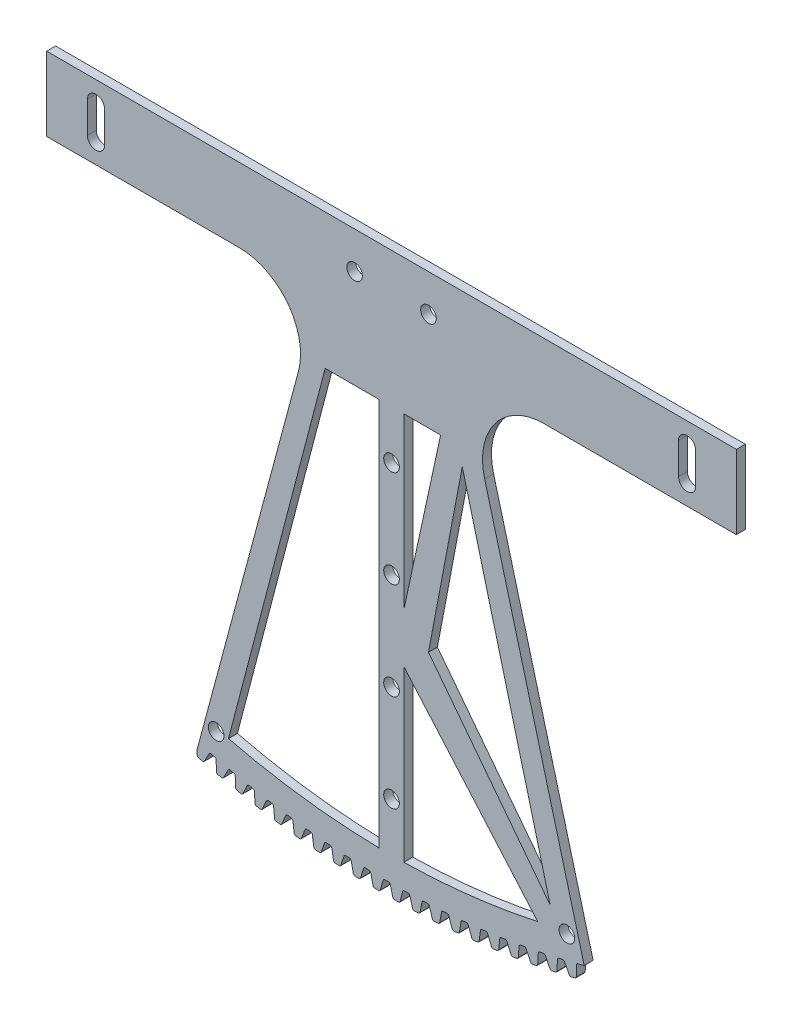
from build123d import *

# Parameters (mm, degrees)
BOSS_EXTRUDE2_DEPTH      = 3.628571429
FILLET1_R                = 25
BOSS_EXTRUDE4_DEPTH      = 3.628571429
CUT_EXTRUDE2_DEPTH       = 336.434355024
FILLET2_R                = 0.7
CIRPATTERN8_COUNT        = 20
CIRPATTERN8_ANGLE        = 28.5
FILLET2_OF_CIRPATTERN8_R = 0.7
SKETCH5_R                = 3.175
CUT_EXTRUDE3_DEPTH       = 338.740173511
SKETCH17_R               = 3.175
CUT_EXTRUDE4_DEPTH       = 338.740173511
FILLET3_R                = 0.7
CUT_EXTRUDE5_DEPTH       = 13


with BuildPart() as part:
    # Sketch3 → Boss-Extrude2 (new body)
    with BuildSketch(Plane.XY):
        with BuildLine():
            Line((-140, -79.56), (-140, -109.56))
            Line((-140, -109.56), (-29.356513523, -109.56))
            Line((-29.356513523, -109.56), (-78.888044947, -294.414191853))
            ThreePointArc((-78.888044947, -294.414191853), (0, -304.8), (78.888044947, -294.414191853))
            Line((78.888044947, -294.414191853), (29.356513523, -109.56))
            Line((29.356513523, -109.56), (140, -109.56))
            Line((140, -109.56), (140, -79.56))
            Line((140, -79.56), (-140, -79.56))
        make_face()
    extrude(amount=BOSS_EXTRUDE2_DEPTH)

    # Fillet1
    fillet1_edges = [part.edges().sort_by_distance(p)[0] for p in [
        (29.356513523, -109.56, 1.814285714),
        (-29.356513523, -109.56, 1.814285714),
    ]]
    fillet(fillet1_edges, radius=FILLET1_R)

    # Sketch14 → Boss-Extrude4 (add)
    with BuildSketch(Plane(origin=(0, 0, 0), x_dir=(-1, 0, 0), z_dir=(0, 0, -1))):
        with BuildLine():
            Line((78.910933272, -297.036934084), (78.888044947, -294.414191853))
            ThreePointArc((78.888044947, -294.414191853), (76.959432674, -294.924203351), (75.027523715, -295.421581279))
            Line((75.027523715, -295.421581279), (76.289081309, -297.721097125))
            Line((76.289081309, -297.721097125), (78.910933272, -297.036934084))
        make_face()
    boss_extrude4 = extrude(amount=-BOSS_EXTRUDE4_DEPTH)

    # Sketch16 → Cut-Extrude2 (cut, symmetric)
    with BuildSketch(Plane(origin=(0, 0, 0), x_dir=(-1, 0, 0), z_dir=(0, 0, -1))):
        Polygon((372.937709596, -838.440145613), (75.027523715, -295.421581279), (73.765262731, -293.12078332), (71.19993834, -293.754449124), (71.154137831, -296.378353915), (60.344615656, -915.654378233), (357.400151379, -2118.250141136), (669.993245319, -2041.035908516), align=None)
    cut_extrude2 = extrude(amount=CUT_EXTRUDE2_DEPTH, both=True, mode=Mode.SUBTRACT)

    # Fillet2
    fillet2_edges = [part.edges().sort_by_distance(p)[0] for p in [
        (-76.289081309, -297.721097125, 1.814285714),
        (-78.910933272, -297.036934084, 1.814285714),
    ]]
    fillet(fillet2_edges, radius=FILLET2_R)

    # CirPattern8: Boss-Extrude4, Cut-Extrude2 ×20 about axis
    cirpattern8_axis = Axis((0, 0, 0), (0, 0, 1))
    add([boss_extrude4.rotate(cirpattern8_axis, i * CIRPATTERN8_ANGLE / (CIRPATTERN8_COUNT - 1)) for i in range(1, CIRPATTERN8_COUNT)])
    add([cut_extrude2.rotate(cirpattern8_axis, i * CIRPATTERN8_ANGLE / (CIRPATTERN8_COUNT - 1)) for i in range(1, CIRPATTERN8_COUNT)], mode=Mode.SUBTRACT)

    # Fillet2 of CirPattern8
    fillet2_of_cirpattern8_edges = [part.edges().sort_by_distance(p)[0] for p in [
        (-68.469509176, -299.616090878, 1.814285714),
        (-71.108371997, -299.000794367, 1.814285714),
        (-60.603011462, -301.305742729, 1.814285714),
        (-63.257076596, -300.75973444, 1.814285714),
        (-52.694979472, -302.788894675, 1.814285714),
        (-55.362427954, -302.312548815, 1.814285714),
        (-44.750832974, -304.064530237, 1.814285714),
        (-47.429836669, -303.65817327, 1.814285714),
        (-36.776016491, -305.131775158, 1.814285714),
        (-39.464739344, -304.795685581, 1.814285714),
        (-28.775995563, -305.989898002, 1.814285714),
        (-31.472594858, -305.724306153, 1.814285714),
        (-20.756253006, -306.638310655, 1.814285714),
        (-23.458880627, -306.443398558, 1.814285714),
        (-12.722285149, -307.076568726, 1.814285714),
        (-15.429088851, -306.952469964, 1.814285714),
        (-4.679598073, -307.304371856, 1.814285714),
        (-7.388722748, -307.251171481, 1.814285714),
        (3.366296165, -307.32156392, 1.814285714),
        (0.656707216, -307.339298391, 1.814285714),
        (11.409883312, -307.128133135, 1.814285714),
        (8.701687106, -307.216790299, 1.814285714),
        (19.445650695, -306.724212069, 1.814285714),
        (16.740703294, -306.883731164, 1.814285714),
        (27.468091, -306.110077549, 1.814285714),
        (24.76824624, -306.340349249, 1.814285714),
        (35.471706048, -305.286150472, 1.814285714),
        (32.778814268, -305.587016961, 1.814285714),
        (43.45101056, -304.252995517, 1.814285714),
        (40.766917333, -304.624250596, 1.814285714),
        (51.40053592, -303.011320757, 1.814285714),
        (48.72708079, -303.452709986, 1.814285714),
        (59.31483392, -301.561977174, 1.814285714),
        (56.65384914, -302.073198046, 1.814285714),
        (67.188480496, -299.905958075, 1.814285714),
        (64.541789771, -300.486660225, 1.814285714),
        (75.016079444, -298.044398412, 1.814285714),
        (72.385496683, -298.694183857, 1.814285714),
    ]]
    fillet(fillet2_of_cirpattern8_edges, radius=FILLET2_OF_CIRPATTERN8_R)

    # Sketch5 → Cut-Extrude3 (cut, through all)
    with BuildSketch(Plane(origin=(0, 0, 0), x_dir=(-1, 0, 0), z_dir=(0, 0, -1))):
        with Locations((-15, -94.56)):
            Circle(SKETCH5_R)
        with Locations((15, -94.56)):
            Circle(SKETCH5_R)
        with BuildLine():
            Line((-123.5, -94.56), (-123.5, -100.91))
            ThreePointArc((-123.5, -100.91), (-120, -104.41), (-116.5, -100.91))
            Line((-116.5, -100.91), (-116.5, -94.56))
            Line((-116.5, -94.56), (-116.5, -88.21))
            ThreePointArc((-116.5, -88.21), (-120, -84.71), (-123.5, -88.21))
            Line((-123.5, -88.21), (-123.5, -94.56))
        make_face()
        with BuildLine():
            Line((116.5, -94.56), (116.5, -88.21))
            ThreePointArc((116.5, -88.21), (120, -84.71), (123.5, -88.21))
            Line((123.5, -88.21), (123.5, -94.56))
            Line((123.5, -94.56), (123.5, -100.91))
            ThreePointArc((123.5, -100.91), (120, -104.41), (116.5, -100.91))
            Line((116.5, -100.91), (116.5, -94.56))
        make_face()
    extrude(amount=-CUT_EXTRUDE3_DEPTH, mode=Mode.SUBTRACT)

    # Sketch17 → Cut-Extrude4 (cut, through all)
    with BuildSketch(Plane(origin=(0, 0, 0), x_dir=(-1, 0, 0), z_dir=(0, 0, -1))):
        with BuildLine():
            Line((66.194365296, -284.361242536), (26.937147844, -134.56))
            Line((26.937147844, -134.56), (5, -134.56))
            Line((5, -134.56), (5, -292.259285824))
            ThreePointArc((5, -292.259285824), (35.815557854, -290.00224429), (66.194365296, -284.361242536))
        make_face()
        Polygon((-28.711660115, -141.33134449), (-64.419853025, -277.589898046), (-15, -213.409642912), align=None)
        with BuildLine():
            Line((-5, -223.409642912), (-59.372890863, -285.932066063))
            ThreePointArc((-59.372890863, -285.932066063), (-32.341547535, -290.428544105), (-5, -292.259285824))
            Line((-5, -292.259285824), (-5, -223.409642912))
        make_face()
        Polygon((-19.937147844, -134.56), (-5, -203.409642912), (-5, -134.56), align=None)
        with Locations((0, -272.546875096)):
            Circle(SKETCH17_R)
        with Locations((0, -233.12205364)):
            Circle(SKETCH17_R)
        with Locations((0, -193.697232184)):
            Circle(SKETCH17_R)
        with Locations((0, -154.272410728)):
            Circle(SKETCH17_R)
        with Locations((-71.194365296, -284.361242536)):
            Circle(SKETCH17_R)
        with Locations((71.194365296, -284.361242536)):
            Circle(SKETCH17_R)
    extrude(amount=-CUT_EXTRUDE4_DEPTH, mode=Mode.SUBTRACT)

    # Fillet3
    fillet3_edges = [part.edges().sort_by_distance(p)[0] for p in [
        (-73.765262731, -293.12078332, 1.814285714),
        (-8.569064657, -302.138509182, 1.814285714),
        (-11.210077084, -302.052051428, 1.814285714),
        (-16.475192389, -301.810661899, 1.814285714),
        (-19.113036607, -301.655100125, 1.814285714),
        (-24.370028848, -301.275968663, 1.814285714),
        (-27.002897009, -301.051409485, 1.814285714),
        (-32.248163305, -300.534795928, 1.814285714),
        (-34.874250975, -300.241393247, 1.814285714),
        (-40.104196483, -299.587651655, 1.814285714),
        (-42.721703871, -299.225606555, 1.814285714),
        (-47.932744248, -298.435184971, 1.814285714),
        (-50.539877446, -298.004745579, 1.814285714),
        (-55.728441303, -297.078185719, 1.814285714),
        (-58.323413512, -296.579647036, 1.814285714),
        (-63.485944869, -295.517583917, 1.814285714),
        (-66.066977625, -294.951287618, 1.814285714),
        (-71.19993834, -293.754449124, 1.814285714),
        (75.038974367, -292.797301774, 1.814285714),
        (69.922119576, -294.061226268, 1.814285714),
        (67.348720552, -294.661258804, 1.814285714),
        (62.200533493, -295.790806539, 1.814285714),
        (59.612309287, -296.323269727, 1.814285714),
        (54.436318271, -297.317666568, 1.814285714),
        (51.835042724, -297.782195482, 1.814285714),
        (46.634795115, -298.640759918, 1.814285714),
        (44.022251011, -299.037036194, 1.814285714),
        (38.801310801, -299.75917981, 1.814285714),
        (36.179288646, -300.08693186, 1.814285714),
        (30.941234006, -300.672159732, 1.814285714),
        (28.311530805, -300.931162932, 1.814285714),
        (23.059951635, -301.379073976, 1.814285714),
        (20.424369654, -301.569150817, 1.814285714),
        (15.162865125, -301.879438056, 1.814285714),
        (12.52321066, -302.000458269, 1.814285714),
        (7.255386744, -302.172909049, 1.814285714),
        (4.613468884, -302.224789693, 1.814285714),
        (-0.657064116, -302.259285824, 1.814285714),
        (-3.299434734, -302.241991342, 1.814285714),
    ]]
    fillet(fillet3_edges, radius=FILLET3_R)

    # Sketch18 → Cut-Extrude5 (cut)
    with BuildSketch(Plane.XY.offset(3.628571429)):
        with BuildLine():
            Line((77.595784531, -292.13011112), (78.384969389, -295.10120886))
            Line((78.384969389, -295.10120886), (79.663287965, -294.761661073))
            Line((79.663287965, -294.761661073), (78.230653441, -291.960737878))
            ThreePointArc((78.230653441, -291.960737878), (77.91326501, -292.045597014), (77.595784531, -292.13011112))
        make_face()
    extrude(amount=-CUT_EXTRUDE5_DEPTH, mode=Mode.SUBTRACT)


solid = part.part
